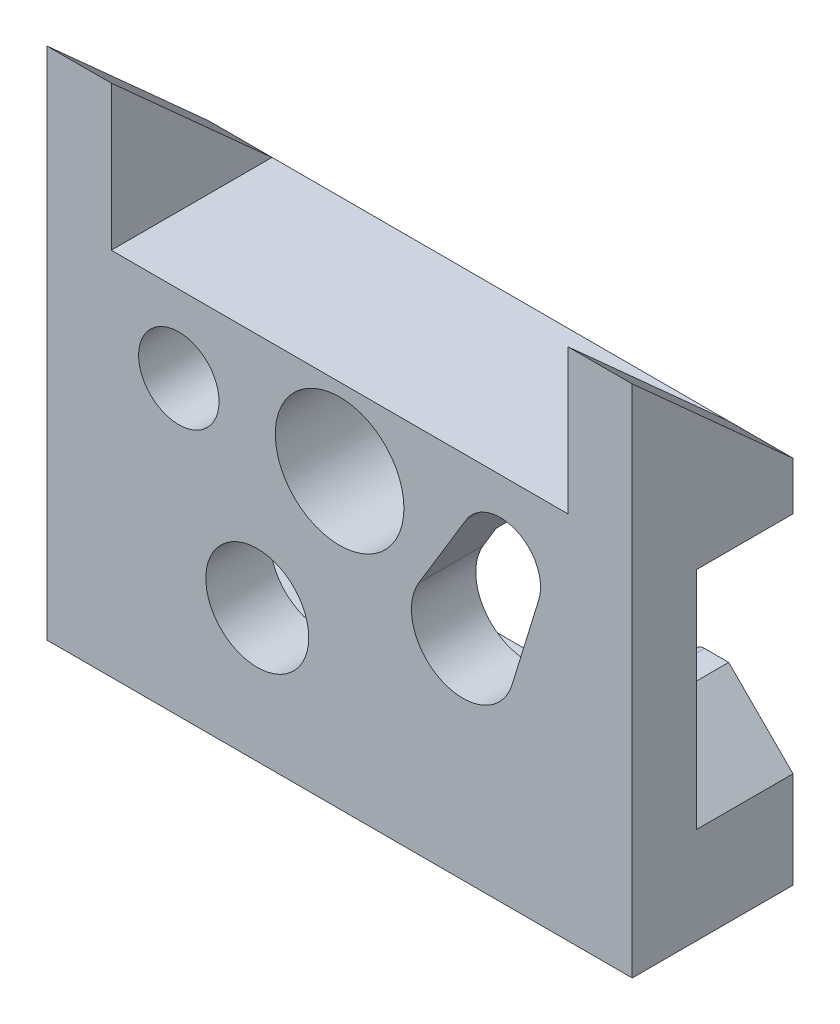
from build123d import *

# Parameters (mm, degrees)
OUTER_FRAME_EXTRUDE_DEPTH      = 4
OUTER_FRAME_EXTRUDE_DEPTH_BACK = 2
OUTSIDE_FRAME_W                = 18.2
OUTSIDE_FRAME_H                = 18.2
OUTSIDE_FRAME_W_2              = 14.2
OUTSIDE_FRAME_H_2              = 14.2
HOTSWAP_BASE_W                 = 18.2
HOTSWAP_BASE_H                 = 11.5
HOTSWAP_BASE_BLOCK_DEPTH       = 5
CUT_EXTRUDE4_DEPTH             = 16.704139582
CUT_EXTRUDE4_DEPTH_BACK        = 16.704139582
SKETCH1_W                      = 2
SKETCH1_H                      = 6.7
CUT_EXTRUDE1_DEPTH             = 4
SWITCH_PIN_HOLES_R             = 2
SWITCH_PIN_HOLES_R_2           = 1.25
SWITCH_HOLES_DEPTH             = 4
CUT_EXTRUDE3_REACH             = 17.704
HOTSWAP_HOLES_R                = 1.6
CHAMFER1_SIZE                  = 2
CHAMFER2_SIZE                  = 4.5
CHAMFER2_SIZE2                 = 4.997756317
FILLET1_R                      = 0.35


with BuildPart() as part:
    # Outside Frame → Outer Frame Extrude (new, two sides: drawn at the far end of the back side and taken through both)
    with BuildSketch(Plane.XY.offset(-4).offset(-OUTER_FRAME_EXTRUDE_DEPTH_BACK)):
        Rectangle(OUTSIDE_FRAME_W, OUTSIDE_FRAME_H)
        Rectangle(OUTSIDE_FRAME_W_2, OUTSIDE_FRAME_H_2, mode=Mode.SUBTRACT)
    extrude(amount=OUTER_FRAME_EXTRUDE_DEPTH + OUTER_FRAME_EXTRUDE_DEPTH_BACK)

    # Hotswap Base → Hotswap Base Block (add)
    with BuildSketch(Plane.XY.offset(-4)):
        with Locations((0, -3.35)):
            Rectangle(HOTSWAP_BASE_W, HOTSWAP_BASE_H)
    extrude(amount=-HOTSWAP_BASE_BLOCK_DEPTH)

    # Sketch1 → Cut-Extrude4 (cut, two sides: drawn at the far end of the back side and taken through both)
    with BuildSketch(Plane(origin=(0, 0, 0), x_dir=(0, 0, -1), z_dir=(1, 0, 0)).offset(-CUT_EXTRUDE4_DEPTH_BACK)):
        with Locations((5, 5.75)):
            Rectangle(SKETCH1_W, SKETCH1_H)
    extrude(amount=CUT_EXTRUDE4_DEPTH + CUT_EXTRUDE4_DEPTH_BACK, mode=Mode.SUBTRACT)

    # Hotswap Well → Cut-Extrude1 (cut)
    with BuildSketch(Plane(origin=(0, 0, -6), x_dir=(-1, 0, 0), z_dir=(0, 0, -1))):
        with BuildLine():
            Line((-10, -1.1), (-2.355843798, -1.1))
            ThreePointArc((-2.355843798, -1.1), (-1.396424004, -2.19317122), (0, -2.6))
            Line((0, -2.6), (5, -2.6))
            Line((5, -2.6), (5, -3.35))
            Line((5, -3.35), (10, -3.35))
            Line((10, -3.35), (10, -6.9))
            Line((10, -6.9), (-6, -6.9))
            Line((-6, -6.9), (-6, -4.1))
            Line((-6, -4.1), (-10, -4.1))
            Line((-10, -4.1), (-10, -1.1))
        make_face()
    extrude(amount=CUT_EXTRUDE1_DEPTH, mode=Mode.SUBTRACT)

    # Switch Pin Holes → Switch Holes (cut)
    with BuildSketch(Plane.XY.offset(-4)):
        Circle(SWITCH_PIN_HOLES_R)
        with Locations((-5, 0)):
            Circle(SWITCH_PIN_HOLES_R_2)
        with Locations((5, 0)):
            Circle(SWITCH_PIN_HOLES_R_2)
    extrude(amount=-SWITCH_HOLES_DEPTH, mode=Mode.SUBTRACT)

    # Cut-Extrude3: up to this face of the body (flat: up to its plane)
    cut_extrude3_end = Plane(part.part.faces().sort_by_distance((5, 0.029137252, -8))[0])
    # Hotswap Holes → Cut-Extrude3 (cut, up to the picked face)
    with BuildSketch(Plane.XY, mode=Mode.PRIVATE) as cut_extrude3_sk1:
        with Locations((-2.560136595, -4.965291588)):
            Circle(HOTSWAP_HOLES_R)
    cut_extrude3_tool1 = split(extrude(cut_extrude3_sk1.sketch, amount=-CUT_EXTRUDE3_REACH, mode=Mode.PRIVATE), bisect_by=cut_extrude3_end, keep=Keep.BOTH, mode=Mode.PRIVATE)
    # Hotswap Holes → Cut-Extrude3 (cut, up to the picked face)
    with BuildSketch(Plane.XY, mode=Mode.PRIVATE) as cut_extrude3_sk2:
        with BuildLine():
            Line((3.930924016, 0.647747281), (2.46548889, -1.77088348))
            ThreePointArc((2.46548889, -1.77088348), (3.179147124, -4.059894044), (5.3631684, -3.070485887))
            Line((5.3631684, -3.070485887), (6.194736133, -0.367567099))
            ThreePointArc((6.194736133, -0.367567099), (5.511530489, 1.140542222), (3.930924016, 0.647747281))
        make_face()
    cut_extrude3_tool2 = split(extrude(cut_extrude3_sk2.sketch, amount=-CUT_EXTRUDE3_REACH, mode=Mode.PRIVATE), bisect_by=cut_extrude3_end, keep=Keep.BOTH, mode=Mode.PRIVATE)
    add(cut_extrude3_tool1.solids().sort_by(Axis((-2.560137, -4.965292, 0), (0, 0, -1)))[0], mode=Mode.SUBTRACT)
    add(cut_extrude3_tool2.solids().sort_by(Axis((4.301523, -1.557372, 0), (0, 0, -1)))[0], mode=Mode.SUBTRACT)

    # Chamfer1
    chamfer1_edges = [part.edges().sort_by_distance(p)[0] for p in [
        (9.1, -4.1, -7.5),
        (-9.1, -6.9, -7.5),
        (-9.1, -3.35, -7.5),
        (9.1, -1.1, -7.5),
    ]]
    chamfer(chamfer1_edges, length=CHAMFER1_SIZE)

    # Chamfer2
    chamfer2_edges = [part.edges().sort_by_distance(p)[0] for p in [
        (-8.1, 2.4, -4),
        (8.1, 2.4, -4),
    ]]
    chamfer2_side = [part.faces().sort_by_distance(p)[0] for p in [
        (8.1, 2.593940713, -4),
    ]]
    chamfer(chamfer2_edges, length=CHAMFER2_SIZE, length2=CHAMFER2_SIZE2, reference=chamfer2_side[0])

    # Fillet1
    fillet1_edges = [part.edges().sort_by_distance(p)[0] for p in [
        (6, -4.1, -7.5),
        (-5, -3.35, -7.5),
        (-5, -2.6, -7.5),
        (6, -6.9, -7.5),
        (2.355843798, -1.1, -7.5),
    ]]
    fillet(fillet1_edges, radius=FILLET1_R)

    # Split1
    split(bisect_by=Plane.XY.offset(-4), keep=Keep.BOTTOM)


solid = part.part
